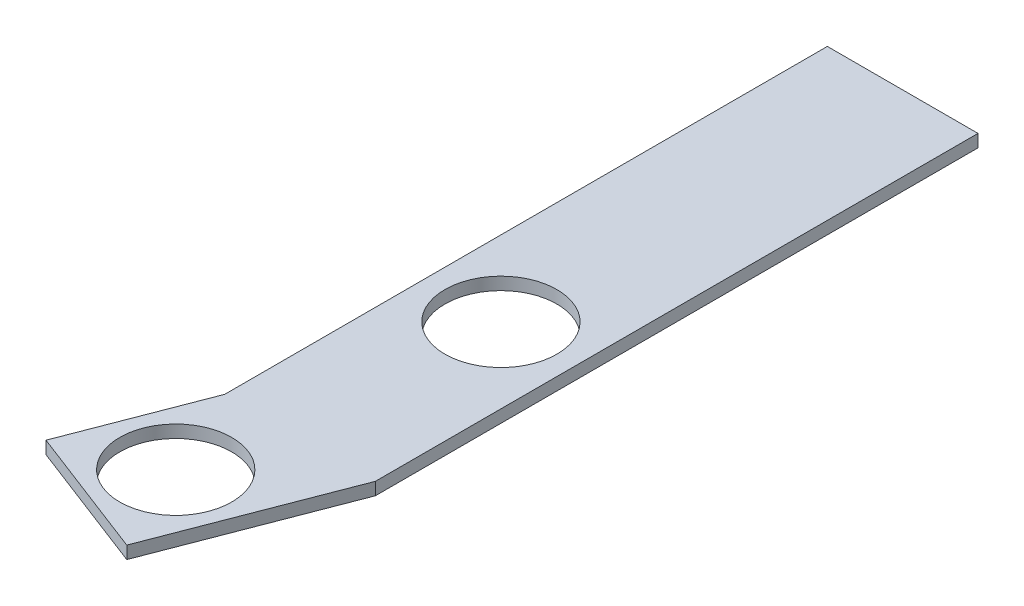
from build123d import *

# Parameters (mm, degrees)
BOSS_EXTRUDE1_DEPTH = 3.175
SKETCH2_R           = 14.1605
CUT_EXTRUDE1_DEPTH  = 126.68689151
SKETCH3_R           = 14.1605
CUT_EXTRUDE2_DEPTH  = 126.68689151


with BuildPart() as part:
    # Sketch1 → Boss-Extrude1 (new body)
    with BuildSketch(Plane(origin=(0, 0, 0), x_dir=(1, 0, 0), z_dir=(0, 1, 0))):
        Polygon((-19.05, -76.2), (-31.605279538, -108.840396317), (1.584053795, -121.606827019), (19.05, -76.2), (19.05, 76.2), (-19.05, 76.2), align=None)
    extrude(amount=BOSS_EXTRUDE1_DEPTH)

    # Sketch2 → Cut-Extrude1 (cut, through all)
    with BuildSketch(Plane(origin=(0, 3.175, 0), x_dir=(1, 0, 0), z_dir=(0, 1, 0))):
        with Locations(Location((-8.732973102, -98.90341351, 0), (0, 0, 270))):
            Circle(SKETCH2_R)
    extrude(amount=-CUT_EXTRUDE1_DEPTH, mode=Mode.SUBTRACT)

    # Sketch3 → Cut-Extrude2 (cut, through all)
    with BuildSketch(Plane(origin=(0, 3.175, 0), x_dir=(1, 0, 0), z_dir=(0, 1, 0))):
        with Locations(Location((0, -25.4, 0), (0, 0, 270))):
            Circle(SKETCH3_R)
    extrude(amount=-CUT_EXTRUDE2_DEPTH, mode=Mode.SUBTRACT)


solid = part.part
